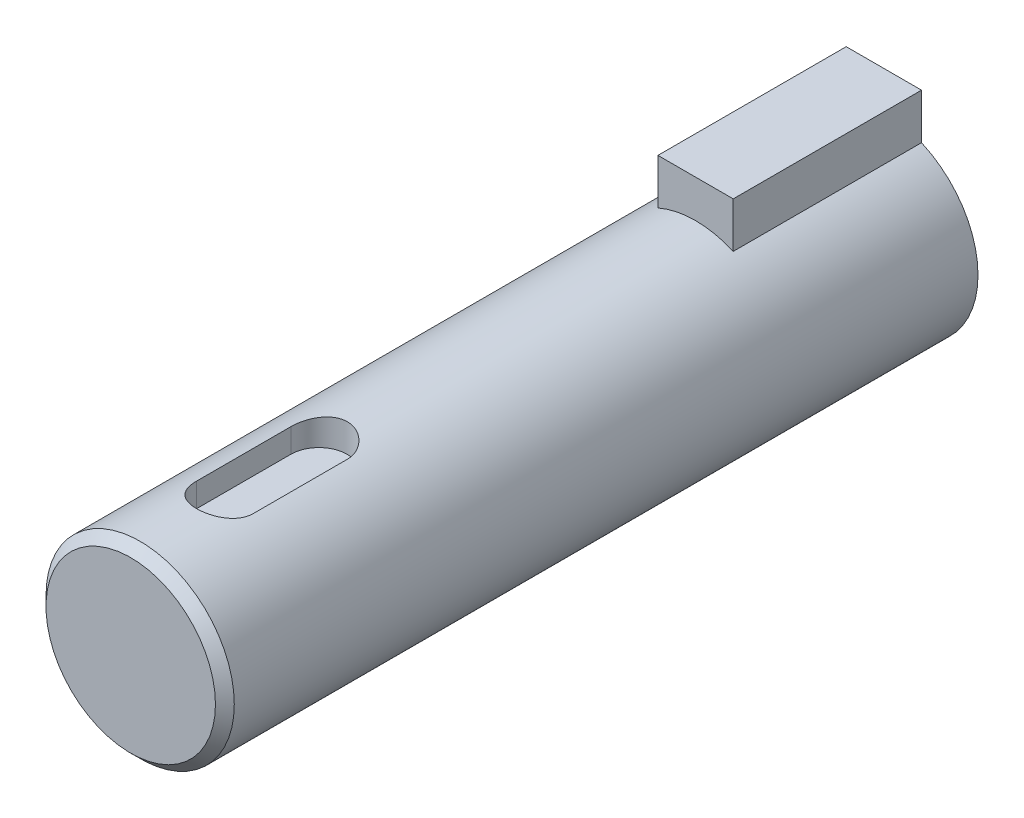
from build123d import *

# Parameters (mm, degrees)
BOSS_EXTRUDE1_DEPTH = 10
SKETCH2_R           = 5
BOSS_EXTRUDE2_DEPTH = 30
CUT_EXTRUDE1_START  = 3.5
CUT_EXTRUDE1_DEPTH  = 38.414545091
CHAMFER1_SIZE       = 0.5


with BuildPart() as part:
    # Sketch1 → Boss-Extrude1 (new body)
    with BuildSketch(Plane.XY):
        with BuildLine():
            Line((-2, 7), (2, 7))
            Line((2, 7), (2, 4.582575695))
            ThreePointArc((2, 4.582575695), (0, -5), (-2, 4.582575695))
            Line((-2, 4.582575695), (-2, 7))
        make_face()
    extrude(amount=BOSS_EXTRUDE1_DEPTH)

    # Sketch2 → Boss-Extrude2 (add)
    with BuildSketch(Plane.XY.offset(10)):
        with Locations(Location((0, 0, 0), (0, 0, 113.578178478))):
            Circle(SKETCH2_R)
    extrude(amount=BOSS_EXTRUDE2_DEPTH)

    # Sketch3 → Cut-Extrude1 (cut, through all)
    with BuildSketch(Plane(origin=(0, 0, 0), x_dir=(1, 0, 0), z_dir=(0, 1, 0)).offset(CUT_EXTRUDE1_START)):
        with BuildLine():
            Line((1.5, -30), (1.5, -35))
            ThreePointArc((1.5, -35), (0, -36.5), (-1.5, -35))
            Line((-1.5, -35), (-1.5, -30))
            ThreePointArc((-1.5, -30), (0, -28.5), (1.5, -30))
        make_face()
    extrude(amount=CUT_EXTRUDE1_DEPTH, mode=Mode.SUBTRACT)

    # Chamfer1
    chamfer1_edges = [part.edges().sort_by_distance(p)[0] for p in [
        (2, -4.582575695, 40),
    ]]
    chamfer(chamfer1_edges, length=CHAMFER1_SIZE)


solid = part.part
